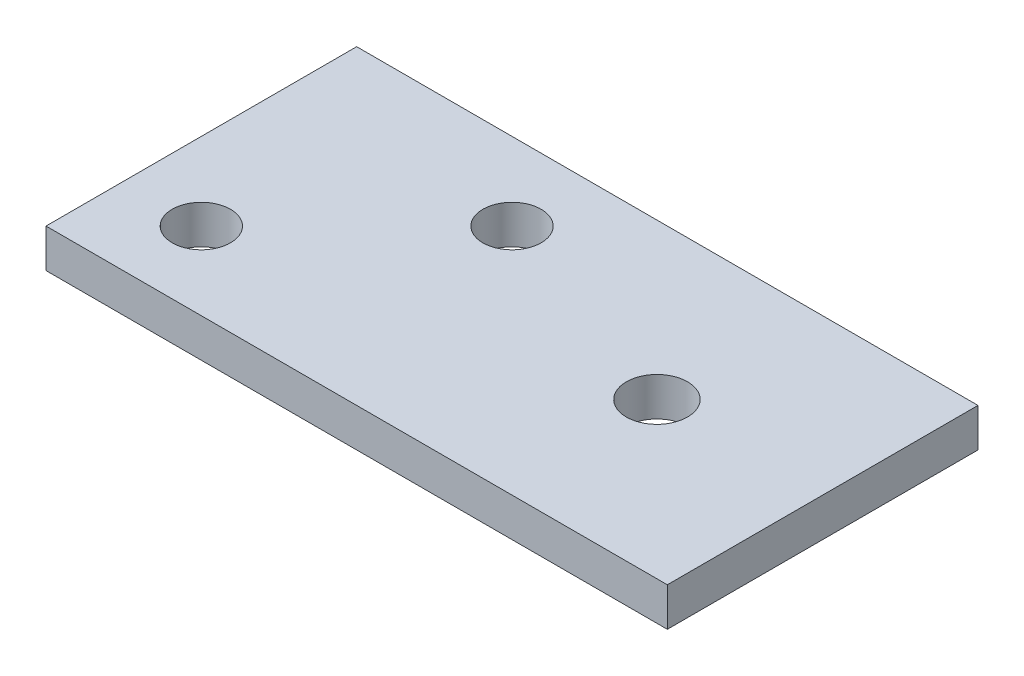
from build123d import *

# Parameters (mm, degrees)
CROQUIS1_W              = 101.6
CROQUIS1_H              = 50.8
SALIENTE_EXTRUIR1_DEPTH = 6.31
CROQUIS2_R              = 4.7625
CORTAR_EXTRUIR1_DEPTH   = 6.31
CROQUIS3_R              = 5
CORTAR_EXTRUIR2_DEPTH   = 10


with BuildPart() as part:
    # Croquis1 → Saliente-Extruir1 (new body)
    with BuildSketch(Plane(origin=(0, 0, 0), x_dir=(1, 0, 0), z_dir=(0, 1, 0))):
        Rectangle(CROQUIS1_W, CROQUIS1_H)
    extrude(amount=SALIENTE_EXTRUIR1_DEPTH)

    # Croquis2 → Cortar-Extruir1 (cut)
    with BuildSketch(Plane(origin=(0, 6.31, 0), x_dir=(1, 0, 0), z_dir=(0, 1, 0))):
        with Locations(Location((-38.1, -12.7, 0), (0, 0, 270))):
            Circle(CROQUIS2_R)
        with Locations(Location((-12.7, 12.7, 0), (0, 0, 270))):
            Circle(CROQUIS2_R)
    extrude(amount=-CORTAR_EXTRUIR1_DEPTH, mode=Mode.SUBTRACT)

    # Croquis3 → Cortar-Extruir2 (cut)
    with BuildSketch(Plane(origin=(0, 6.31, 0), x_dir=(1, 0, 0), z_dir=(0, 1, 0))):
        with Locations(Location((23.7, 0, 0), (0, 0, 270))):
            Circle(CROQUIS3_R)
    extrude(amount=-CORTAR_EXTRUIR2_DEPTH, mode=Mode.SUBTRACT)


solid = part.part
